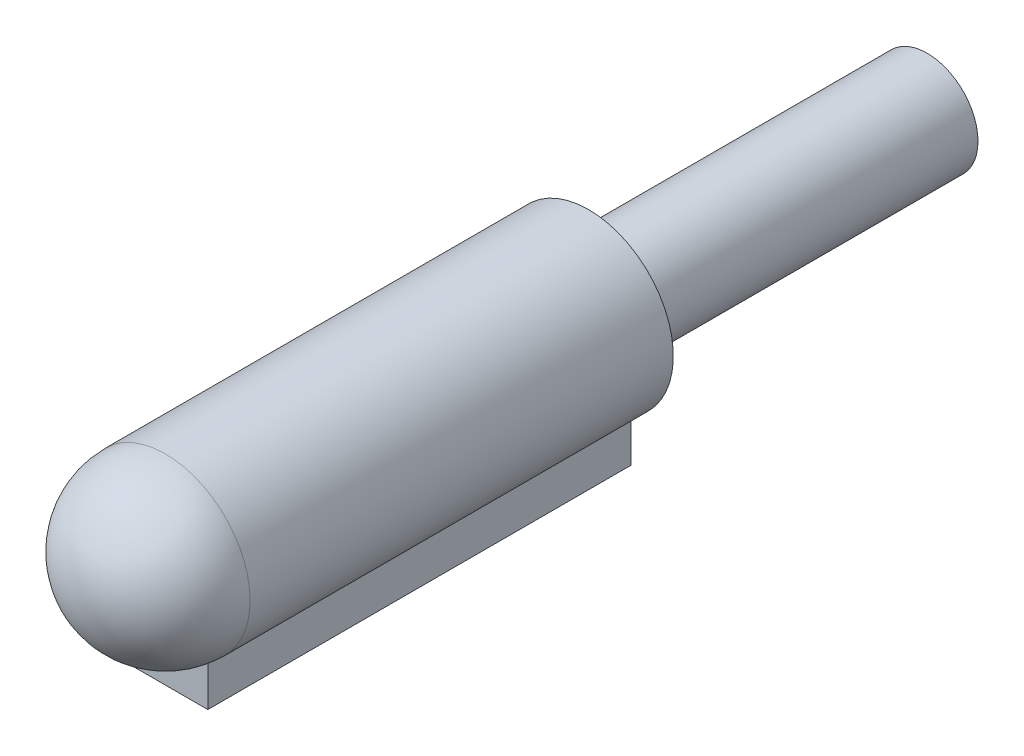
from build123d import *

# Parameters (mm, degrees)
SZKIC1_R                    = 5
DODANIE_WYCI_GNI_CIE1_DEPTH = 30
SZKIC1_3_R                  = 3
DODANIE_WYCI_GNI_CIE2_DEPTH = 20
ZAOKR_GLENIE1_R             = 5
DODANIE_WYCI_GNI_CIE3_DEPTH = 25


with BuildPart() as part:
    # Szkic1 → Dodanie-wyciągnięcie1 (new body)
    with BuildSketch(Plane.XY):
        Circle(SZKIC1_R)
    extrude(amount=DODANIE_WYCI_GNI_CIE1_DEPTH)

    # Szkic1<3> → Dodanie-wyciągnięcie2 (add)
    with BuildSketch(Plane.XY):
        Circle(SZKIC1_3_R)
    extrude(amount=-DODANIE_WYCI_GNI_CIE2_DEPTH)

    # Zaokrąglenie1
    zaokr_glenie1_edges = [part.edges().sort_by_distance(p)[0] for p in [
        (-5, 0, 30),
    ]]
    fillet(zaokr_glenie1_edges, radius=ZAOKR_GLENIE1_R)

    # Szkic3 → Dodanie-wyciągnięcie3 (add)
    with BuildSketch(Plane(origin=(0, 0, 0), x_dir=(-1, 0, 0), z_dir=(0, 0, -1))):
        with BuildLine():
            Line((2.5, -6.830127019), (2.5, -4.330127019))
            ThreePointArc((2.5, -4.330127019), (0, -5), (-2.5, -4.330127019))
            Line((-2.5, -4.330127019), (-2.5, -6.830127019))
            Line((-2.5, -6.830127019), (2.5, -6.830127019))
        make_face()
    extrude(amount=-DODANIE_WYCI_GNI_CIE3_DEPTH)


solid = part.part
